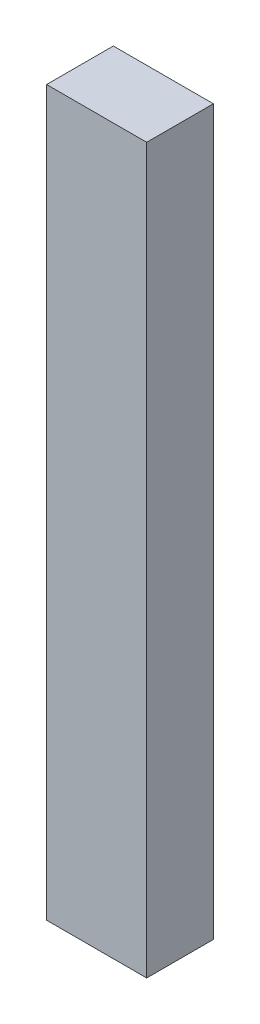
from build123d import *

# Parameters (mm, degrees)
SKETCH1_W           = 30
SKETCH1_H           = 20
BOSS_EXTRUDE1_DEPTH = 217


with BuildPart() as part:
    # Sketch1 → Boss-Extrude1 (new body)
    with BuildSketch(Plane(origin=(0, 0, 0), x_dir=(1, 0, 0), z_dir=(0, 1, 0))):
        with Locations((-32.473684211, -2.815789474)):
            Rectangle(SKETCH1_W, SKETCH1_H)
    extrude(amount=BOSS_EXTRUDE1_DEPTH)


solid = part.part
